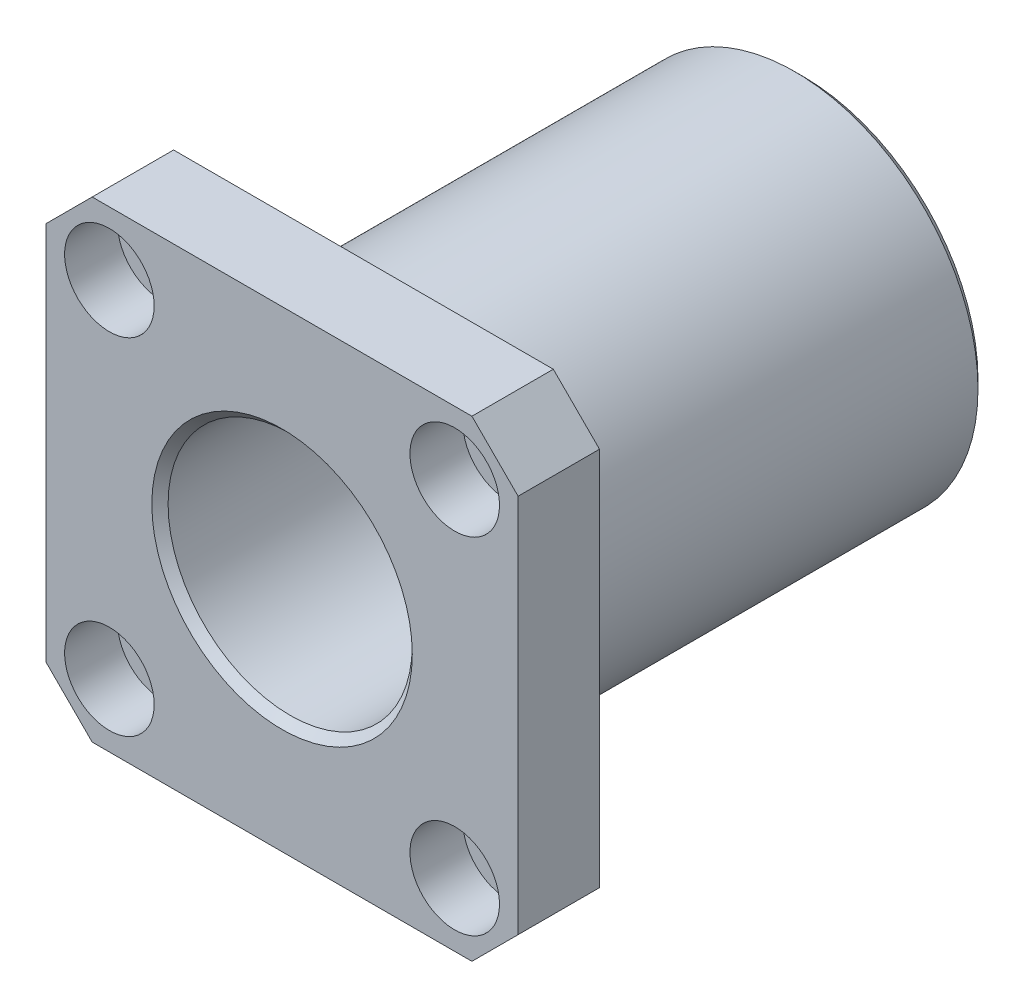
from build123d import *

# Parameters (mm, degrees)
SKETCH1_R                                           = 22.5
BOSS_EXTRUDE1_DEPTH                                 = 64
SKETCH2_W                                           = 58
SKETCH2_H                                           = 58
BOSS_EXTRUDE2_DEPTH                                 = 10
CUT_EXTRUDE1_DEPTH                                  = 77.013156756
CBORE_FOR_M6_HEX_SOCKET_HEAD_CAP_SCREW1_D           = 6.6
CBORE_FOR_M6_HEX_SOCKET_HEAD_CAP_SCREW1_DEPTH       = 22
CBORE_FOR_M6_HEX_SOCKET_HEAD_CAP_SCREW1_CBORE_D     = 11
CBORE_FOR_M6_HEX_SOCKET_HEAD_CAP_SCREW1_CBORE_DEPTH = 6.5
CBORE_FOR_M6_HEX_SOCKET_HEAD_CAP_SCREW1_TIP         = 1.982840043
SKETCH8_R                                           = 15
CUT_EXTRUDE2_DEPTH                                  = 77.013156756
CHAMFER1_SIZE                                       = 1


with BuildPart() as part:
    # Sketch1 → Boss-Extrude1 (new body)
    with BuildSketch(Plane.XY):
        Circle(SKETCH1_R)
    extrude(amount=BOSS_EXTRUDE1_DEPTH)

    # Sketch2 → Boss-Extrude2 (add)
    with BuildSketch(Plane.XY.offset(64)):
        Rectangle(SKETCH2_W, SKETCH2_H)
    extrude(amount=-BOSS_EXTRUDE2_DEPTH)

    # Sketch4 → Cut-Extrude1 (cut, through all)
    with BuildSketch(Plane.XY.offset(64)):
        Polygon((-29, 29), (-29, 23.325901808), (-23.325901808, 29), align=None)
        Polygon((23.325901808, 29), (29, 29), (29, 23.325901808), align=None)
        Polygon((29, -29), (29, -23.325901808), (23.325901808, -29), align=None)
        Polygon((-23.325901808, -29), (-29, -29), (-29, -23.325901808), align=None)
    extrude(amount=-CUT_EXTRUDE1_DEPTH, mode=Mode.SUBTRACT)

    # CBORE for M6 Hex Socket Head Cap Screw1
    with Locations(Plane.XY.offset(64)):
        with Locations((-21.213203436, 21.213203436), (21.213203436, 21.213203436), (21.213203436, -21.213203436), (-21.213203436, -21.213203436)):
            CounterBoreHole(CBORE_FOR_M6_HEX_SOCKET_HEAD_CAP_SCREW1_D / 2, CBORE_FOR_M6_HEX_SOCKET_HEAD_CAP_SCREW1_CBORE_D / 2, CBORE_FOR_M6_HEX_SOCKET_HEAD_CAP_SCREW1_CBORE_DEPTH, depth=CBORE_FOR_M6_HEX_SOCKET_HEAD_CAP_SCREW1_DEPTH)
            with Locations((0, 0, -(CBORE_FOR_M6_HEX_SOCKET_HEAD_CAP_SCREW1_DEPTH + CBORE_FOR_M6_HEX_SOCKET_HEAD_CAP_SCREW1_TIP / 2))):  # 118° drill point
                Cone(0, CBORE_FOR_M6_HEX_SOCKET_HEAD_CAP_SCREW1_D / 2, CBORE_FOR_M6_HEX_SOCKET_HEAD_CAP_SCREW1_TIP, mode=Mode.SUBTRACT)

    # Sketch8 → Cut-Extrude2 (cut, through all)
    with BuildSketch(Plane.XY.offset(64)):
        Circle(SKETCH8_R)
    extrude(amount=-CUT_EXTRUDE2_DEPTH, mode=Mode.SUBTRACT)

    # Chamfer1
    chamfer1_edges = [part.edges().sort_by_distance(p)[0] for p in [
        (-15, 0, 64),
        (-22.5, 0, 0),
    ]]
    chamfer(chamfer1_edges, length=CHAMFER1_SIZE)


solid = part.part
